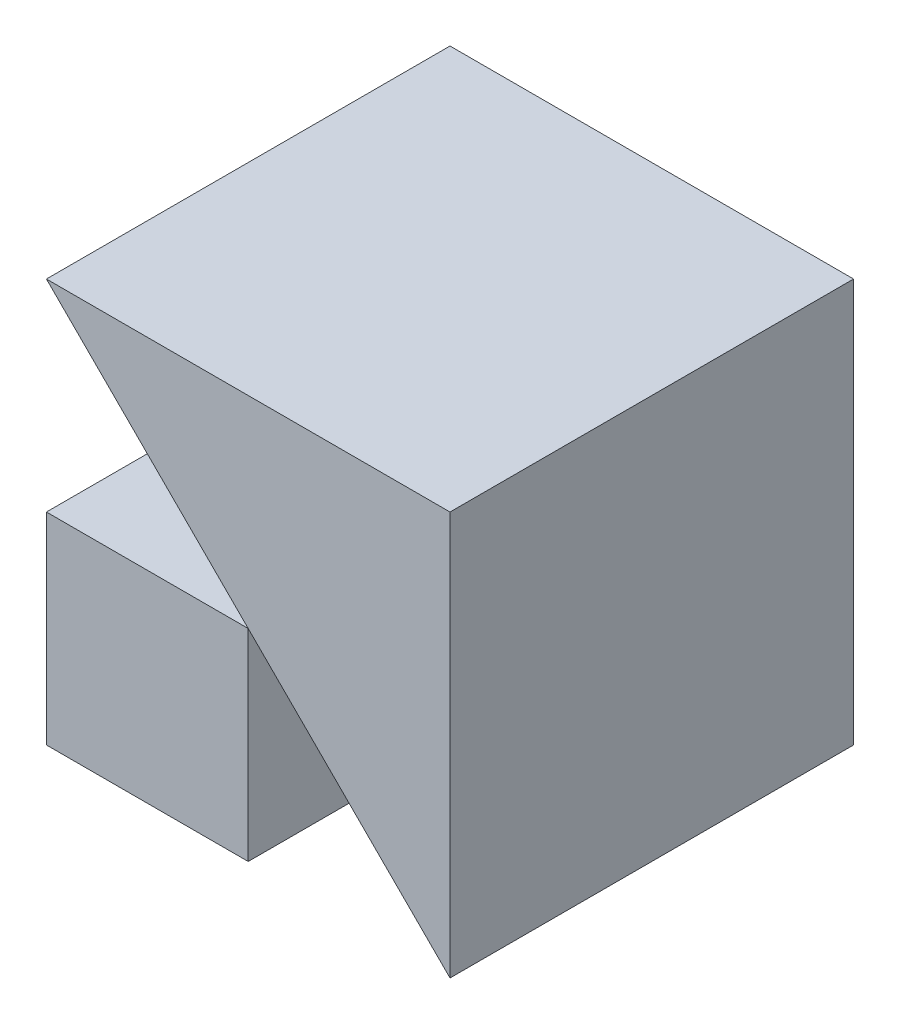
from build123d import *

# Parameters (mm, degrees)
BOSS_EXTRUDE1_DEPTH   = 4
SKETCH1_W             = 2
SKETCH1_H             = 2
BOSS_EXTRUDE1_2_DEPTH = 4


with BuildPart() as part:
    # Sketch1 → Boss-Extrude1 (new body)
    with BuildSketch(Plane.XY):
        Polygon((0, 0), (4, -4), (4, 0), align=None)
    extrude(amount=BOSS_EXTRUDE1_DEPTH)


with BuildPart() as body_2:
    # Sketch1 → Boss-Extrude1 2 (new body)
    with BuildSketch(Plane.XY):
        with Locations((1, -3)):
            Rectangle(SKETCH1_W, SKETCH1_H)
    extrude(amount=BOSS_EXTRUDE1_2_DEPTH)


solid = Compound([part.part, body_2.part])
